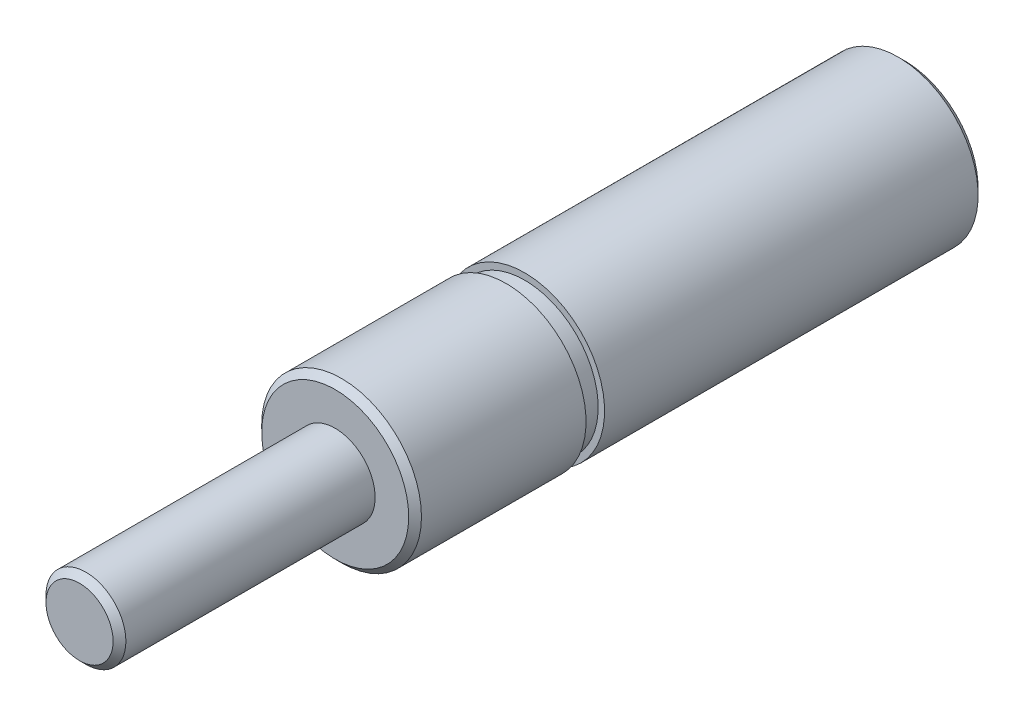
from build123d import *

# Parameters (mm, degrees)
CHAMFER1_SIZE = 0.254


with BuildPart() as part:
    # Sketch1 → Revolve1 (revolve)
    with BuildSketch(Plane(origin=(0, 0, 0), x_dir=(0, 0, -1), z_dir=(1, 0, 0)), mode=Mode.PRIVATE) as revolve1_sk:
        Polygon((0, 0), (0, 1.5875), (10.16, 1.5875), (10.16, 3.175), (16.9545, 3.175), (16.9545, 2.921), (17.6911, 2.921), (17.6911, 3.175), (32.7914, 3.175), (32.7914, 1.5875), (26.4414, 1.5875), (26.4414, 0), align=None)
    revolve(revolve1_sk.sketch.rotate(Axis((0, 0, -26.4414), (0, 0, 1)), 90), axis=Axis((0, 0, -26.4414), (0, 0, 1)))

    # Chamfer1
    chamfer1_edges = [part.edges().sort_by_distance(p)[0] for p in [
        (3.175, 0, -10.16),
        (1.5875, 0, 0),
        (3.175, 0, -32.7914),
    ]]
    chamfer(chamfer1_edges, length=CHAMFER1_SIZE)


solid = part.part
